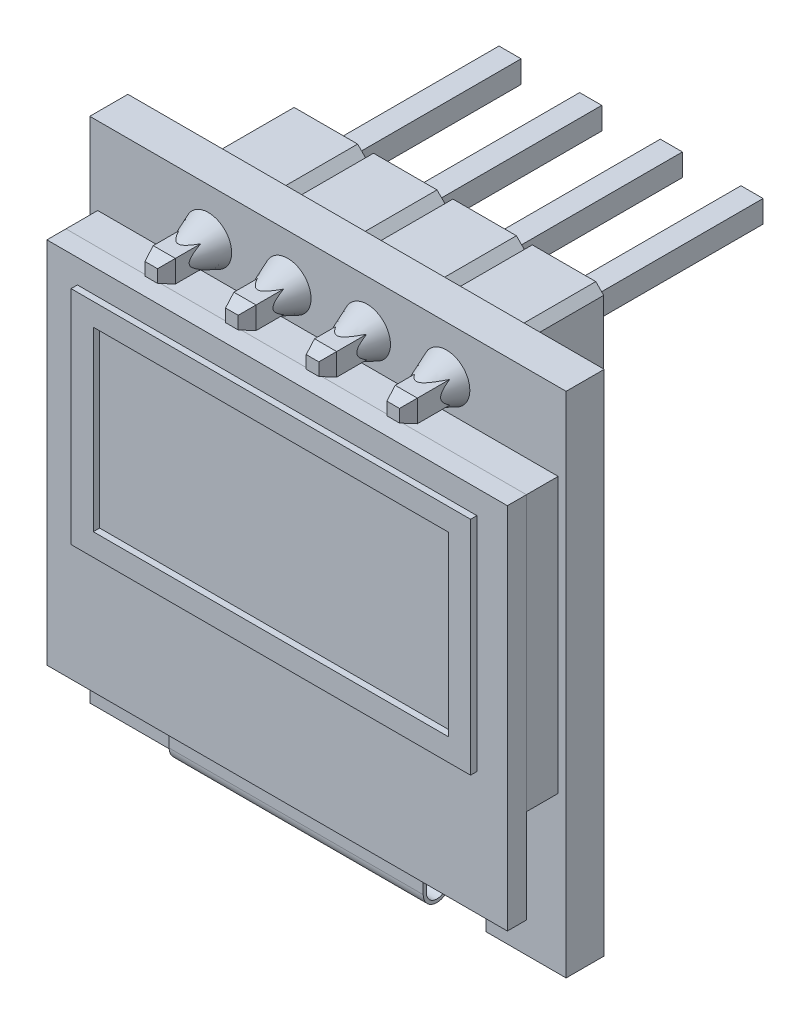
from build123d import *
from OCP.BRepFilletAPI import BRepFilletAPI_MakeChamfer

# Parameters (mm, degrees)
SKETCH1_W                = 14.5
SKETCH1_H                = 11.6
SKETCH1_W_2              = 0.696922127
SKETCH1_H_2              = 0.7
SKETCH1_W_3              = 12.58
SKETCH1_H_3              = 6.98
SKETCH1_W_4              = 11.18
SKETCH1_H_4              = 5.58
BOSS_EXTRUDE1_DEPTH      = 1.2
BOSS_EXTRUDE2_DEPTH      = 1.8
BOSS_EXTRUDE2_DEPTH_BACK = 9.7
SKETCH1_3_W              = 0.696922127
SKETCH1_3_H              = 0.7
BOSS_EXTRUDE3_START      = 1.6
SKETCH1_4_W              = 14.5
SKETCH1_4_H              = 11.6
SKETCH1_4_W_2            = 12.58
SKETCH1_4_H_2            = 6.98
BOSS_EXTRUDE3_DEPTH      = 0.6
SKETCH1_5_W              = 12.58
SKETCH1_5_H              = 6.98
SKETCH1_5_W_2            = 11.18
SKETCH1_5_H_2            = 5.58
BOSS_EXTRUDE4_DEPTH      = 1.8
SKETCH1_6_W              = 11.18
SKETCH1_6_H              = 5.58
BOSS_EXTRUDE5_DEPTH      = 1.6
BOSS_EXTRUDE6_DEPTH      = 2.5
LPATTERN1_COUNT          = 4
LPATTERN1_PITCH          = 2.5
BOSS_EXTRUDE7_START      = -0.6
SKETCH3_W                = 14.5
SKETCH3_H                = 8.64585792
BOSS_EXTRUDE7_DEPTH      = 1
SKETCH4_R                = 0.733632711
BOSS_EXTRUDE8_DEPTH      = 1
BOSS_EXTRUDE8_TAPER      = 22
LPATTERN2_COUNT          = 4
LPATTERN2_PITCH          = 2.5
EXTRUDE_THIN1_DEPTH      = 4
CHAMFER1_SIZE            = 0.15
CHAMFER1_SIZE2           = 0.412121613
CHAMFER2_SIZE            = 0.15
CHAMFER2_SIZE2           = 0.412121613
CHAMFER3_SIZE            = 0.2


with BuildPart() as part:
    # Sketch1 → Boss-Extrude1 (new body)
    # profile 1 of 4: a face of its own
    with BuildSketch(Plane.XY):
        Polygon((171.814961943, 426.555570658), (171.814961943, 427.510394392), (161.853237798, 427.510394392), (161.853237798, 426.555570658), (159.33409987, 426.555570658), (159.33409987, 442.555570658), (174.33409987, 442.555570658), (174.33409987, 426.555570658), align=None)
        with Locations((166.83409987, 434.311004349)):
            Rectangle(SKETCH1_W, SKETCH1_H, mode=Mode.SUBTRACT)
        with Locations((163.068503678, 441.065562707)):
            Rectangle(SKETCH1_W_2, SKETCH1_H_2, mode=Mode.SUBTRACT)
        with Locations((165.608503678, 441.065562707)):
            Rectangle(SKETCH1_W_2, SKETCH1_H_2, mode=Mode.SUBTRACT)
        with Locations((168.148503678, 441.065562707)):
            Rectangle(SKETCH1_W_2, SKETCH1_H_2, mode=Mode.SUBTRACT)
        with Locations((170.688503678, 441.065562707)):
            Rectangle(SKETCH1_W_2, SKETCH1_H_2, mode=Mode.SUBTRACT)
    # profile 2 of 4: a face of its own
    with BuildSketch(Plane.XY):
        with Locations((166.83409987, 434.311004349)):
            Rectangle(SKETCH1_W, SKETCH1_H)
        with Locations((166.83409987, 435.871314227)):
            Rectangle(SKETCH1_W_3, SKETCH1_H_3, mode=Mode.SUBTRACT)
    # profile 3 of 4: a face of its own
    with BuildSketch(Plane.XY):
        with Locations((166.83409987, 435.871314227)):
            Rectangle(SKETCH1_W_3, SKETCH1_H_3)
        with Locations((166.83409987, 435.871314227)):
            Rectangle(SKETCH1_W_4, SKETCH1_H_4, mode=Mode.SUBTRACT)
    # profile 4 of 4: a face of its own
    with BuildSketch(Plane.XY):
        with Locations((166.83409987, 435.871314227)):
            Rectangle(SKETCH1_W_4, SKETCH1_H_4)
    extrude(amount=-BOSS_EXTRUDE1_DEPTH)

    # Sketch1<3> → Boss-Extrude2 (add, two sides: drawn at the far end of the back side and taken through both)
    with BuildSketch(Plane.XY.offset(-BOSS_EXTRUDE2_DEPTH_BACK)):
        with Locations((163.068503678, 441.065562707)):
            Rectangle(SKETCH1_3_W, SKETCH1_3_H)
        with Locations((165.608503678, 441.065562707)):
            Rectangle(SKETCH1_3_W, SKETCH1_3_H)
        with Locations((168.148503678, 441.065562707)):
            Rectangle(SKETCH1_3_W, SKETCH1_3_H)
        with Locations((170.688503678, 441.065562707)):
            Rectangle(SKETCH1_3_W, SKETCH1_3_H)
    extrude(amount=BOSS_EXTRUDE2_DEPTH + BOSS_EXTRUDE2_DEPTH_BACK)

    # Sketch1<5> → Boss-Extrude4 (add)
    with BuildSketch(Plane.XY):
        with Locations((166.83409987, 435.871314227)):
            Rectangle(SKETCH1_5_W, SKETCH1_5_H)
        with Locations((166.83409987, 435.871314227)):
            Rectangle(SKETCH1_5_W_2, SKETCH1_5_H_2, mode=Mode.SUBTRACT)
    extrude(amount=BOSS_EXTRUDE4_DEPTH)

    # Sketch1<6> → Boss-Extrude5 (add)
    with BuildSketch(Plane.XY):
        with Locations((166.83409987, 435.871314227)):
            Rectangle(SKETCH1_6_W, SKETCH1_6_H)
    extrude(amount=BOSS_EXTRUDE5_DEPTH)


with BuildPart() as body_2:
    # Sketch1<4> → Boss-Extrude3 (new body)
    with BuildSketch(Plane.XY.offset(BOSS_EXTRUDE3_START)):
        with Locations((166.83409987, 434.311004349)):
            Rectangle(SKETCH1_4_W, SKETCH1_4_H)
        with Locations((166.83409987, 435.871314227)):
            Rectangle(SKETCH1_4_W_2, SKETCH1_4_H_2, mode=Mode.SUBTRACT)
    extrude(amount=-BOSS_EXTRUDE3_DEPTH)


with BuildPart() as body_3:
    # Sketch2 → Boss-Extrude6 (new body)
    with BuildSketch(Plane(origin=(0, 0, -1.2), x_dir=(-1, 0, 0), z_dir=(0, 0, -1))):
        Polygon((-164.068503677, 442.315562707), (-162.068503677, 442.315562707), (-161.818503677, 442.065562707), (-161.818503677, 440.065562707), (-162.068503677, 439.815562707), (-164.068503677, 439.815562707), (-164.318503677, 440.065562707), (-164.318503677, 442.065562707), align=None)
    boss_extrude6 = extrude(amount=BOSS_EXTRUDE6_DEPTH)


with BuildPart() as lpattern1_1:
    # LPattern1: pattern copy
    add(boss_extrude6.moved(Location(Vector(1, 0, 0) * (1 * LPATTERN1_PITCH))))


with BuildPart() as lpattern1_2:
    # LPattern1: pattern copy
    add(boss_extrude6.moved(Location(Vector(1, 0, 0) * (2 * LPATTERN1_PITCH))))


with BuildPart() as lpattern1_3:
    # LPattern1: pattern copy
    add(boss_extrude6.moved(Location(Vector(1, 0, 0) * (3 * LPATTERN1_PITCH))))


with BuildPart() as body_7:
    # Sketch3 → Boss-Extrude7 (new body)
    with BuildSketch(Plane.XY.offset(1.6).offset(BOSS_EXTRUDE7_START)):
        with Locations((166.83409987, 435.788075389)):
            Rectangle(SKETCH3_W, SKETCH3_H)
    extrude(amount=-BOSS_EXTRUDE7_DEPTH)

    # Sketch6 → Extrude-Thin1 (add, symmetric)
    with BuildSketch(Plane.ZY.offset(-166.83409987)):
        with BuildLine():
            Line((1, 434.311004349), (1, 427.577640227))
            ThreePointArc((1, 427.577640227), (0.568569371, 427.146209598), (0.137138742, 427.577640227))
            Line((0.137138742, 427.577640227), (0.137138742, 429.988075389))
            Line((0.137138742, 429.988075389), (0.237138742, 429.988075389))
            Line((0.237138742, 429.988075389), (0.237138742, 427.577640227))
            ThreePointArc((0.237138742, 427.577640227), (0.568569371, 427.246209598), (0.9, 427.577640227))
            Line((0.9, 427.577640227), (0.9, 434.311004349))
            Line((0.9, 434.311004349), (1, 434.311004349))
        make_face()
    extrude(amount=EXTRUDE_THIN1_DEPTH, both=True)


with BuildPart() as body_8:
    # Sketch4 → Boss-Extrude8 (new body)
    with BuildSketch(Plane.XY):
        with Locations((163.068503677, 441.065562707)):
            Circle(SKETCH4_R)
    boss_extrude8 = extrude(amount=BOSS_EXTRUDE8_DEPTH, taper=BOSS_EXTRUDE8_TAPER)


with BuildPart() as lpattern2_1:
    # LPattern2: pattern copy
    add(boss_extrude8.moved(Location(Vector(1, 0, 0) * (1 * LPATTERN2_PITCH))))


with BuildPart() as lpattern2_2:
    # LPattern2: pattern copy
    add(boss_extrude8.moved(Location(Vector(1, 0, 0) * (2 * LPATTERN2_PITCH))))


with BuildPart() as lpattern2_3:
    # LPattern2: pattern copy
    add(boss_extrude8.moved(Location(Vector(1, 0, 0) * (3 * LPATTERN2_PITCH))))


with BuildPart() as part_1:
    add(part.part)

    # Combine2: union LPattern2_3, LPattern2_2, LPattern2_1, body 8
    add(lpattern2_3.part)
    add(lpattern2_2.part)
    add(lpattern2_1.part)
    add(body_8.part)

    # Chamfer1
    chamfer1_edges = [part_1.edges().sort_by_distance(p)[0] for p in [
        (171.036964741, 441.065562707, 1.8),
        (170.688503677, 441.415562707, 1.8),
        (170.340042614, 441.065562707, 1.8),
        (170.688503677, 440.715562707, 1.8),
    ]]
    chamfer1_side = [part_1.faces().sort_by_distance(p)[0] for p in [
        (170.688503677, 441.065562707, 1.8),
    ]]
    chamfer(chamfer1_edges, length=CHAMFER1_SIZE, length2=CHAMFER1_SIZE2, reference=chamfer1_side[0])

    # Chamfer2: one chamfer whose edges measure the first distance from different faces: ONE call of the kernel's chamfer builder (chamfer() names one face for all edges)
    chamfer2_edges_1 = [part_1.edges().sort_by_distance(p)[0] for p in [
        (168.496964741, 441.065562707, 1.8),
        (168.148503677, 441.415562707, 1.8),
        (167.800042614, 441.065562707, 1.8),
        (168.148503677, 440.715562707, 1.8),
    ]]
    chamfer2_side_1 = [part_1.faces().sort_by_distance(p)[0] for p in [
        (168.148503677, 441.065562707, 1.8),
    ]]
    chamfer2_edges_2 = [part_1.edges().sort_by_distance(p)[0] for p in [
        (163.416964741, 441.065562707, 1.8),
        (163.068503677, 441.415562707, 1.8),
        (162.720042614, 441.065562707, 1.8),
        (163.068503677, 440.715562707, 1.8),
    ]]
    chamfer2_side_2 = [part_1.faces().sort_by_distance(p)[0] for p in [
        (163.068503677, 441.065562707, 1.8),
    ]]
    chamfer2_edges_3 = [part_1.edges().sort_by_distance(p)[0] for p in [
        (165.956964741, 441.065562707, 1.8),
        (165.608503677, 441.415562707, 1.8),
        (165.260042614, 441.065562707, 1.8),
        (165.608503677, 440.715562707, 1.8),
    ]]
    chamfer2_side_3 = [part_1.faces().sort_by_distance(p)[0] for p in [
        (165.608503677, 441.065562707, 1.8),
    ]]
    chamfer2 = BRepFilletAPI_MakeChamfer(part_1.part.solid().wrapped)
    for e in chamfer2_edges_1:
        chamfer2.Add(CHAMFER2_SIZE, CHAMFER2_SIZE2, e.wrapped, chamfer2_side_1[0].wrapped)  # the first distance lies on this face
    for e in chamfer2_edges_2:
        chamfer2.Add(CHAMFER2_SIZE, CHAMFER2_SIZE2, e.wrapped, chamfer2_side_2[0].wrapped)  # the first distance lies on this face
    for e in chamfer2_edges_3:
        chamfer2.Add(CHAMFER2_SIZE, CHAMFER2_SIZE2, e.wrapped, chamfer2_side_3[0].wrapped)  # the first distance lies on this face
    add(Compound.cast(chamfer2.Shape()), mode=Mode.REPLACE)

    # Chamfer3
    chamfer3_edges = [part_1.edges().sort_by_distance(p)[0] for p in [
        (168.148503677, 440.715562707, -9.7),
        (167.800042614, 441.065562707, -9.7),
        (168.496964741, 441.065562707, -9.7),
        (168.148503677, 441.415562707, -9.7),
        (170.688503677, 440.715562707, -9.7),
        (170.340042614, 441.065562707, -9.7),
        (171.036964741, 441.065562707, -9.7),
        (170.688503677, 441.415562707, -9.7),
        (163.068503677, 440.715562707, -9.7),
        (162.720042614, 441.065562707, -9.7),
        (163.416964741, 441.065562707, -9.7),
        (163.068503677, 441.415562707, -9.7),
        (165.608503677, 440.715562707, -9.7),
        (165.260042614, 441.065562707, -9.7),
        (165.956964741, 441.065562707, -9.7),
        (165.608503677, 441.415562707, -9.7),
    ]]
    chamfer(chamfer3_edges, length=CHAMFER3_SIZE)


with BuildPart() as body_3_1:
    add(body_3.part)

    # Combine3: union LPattern1_1, LPattern1_2, LPattern1_3
    add(lpattern1_1.part)
    add(lpattern1_2.part)
    add(lpattern1_3.part)


solid = Compound([body_2.part, body_7.part, part_1.part, body_3_1.part])
